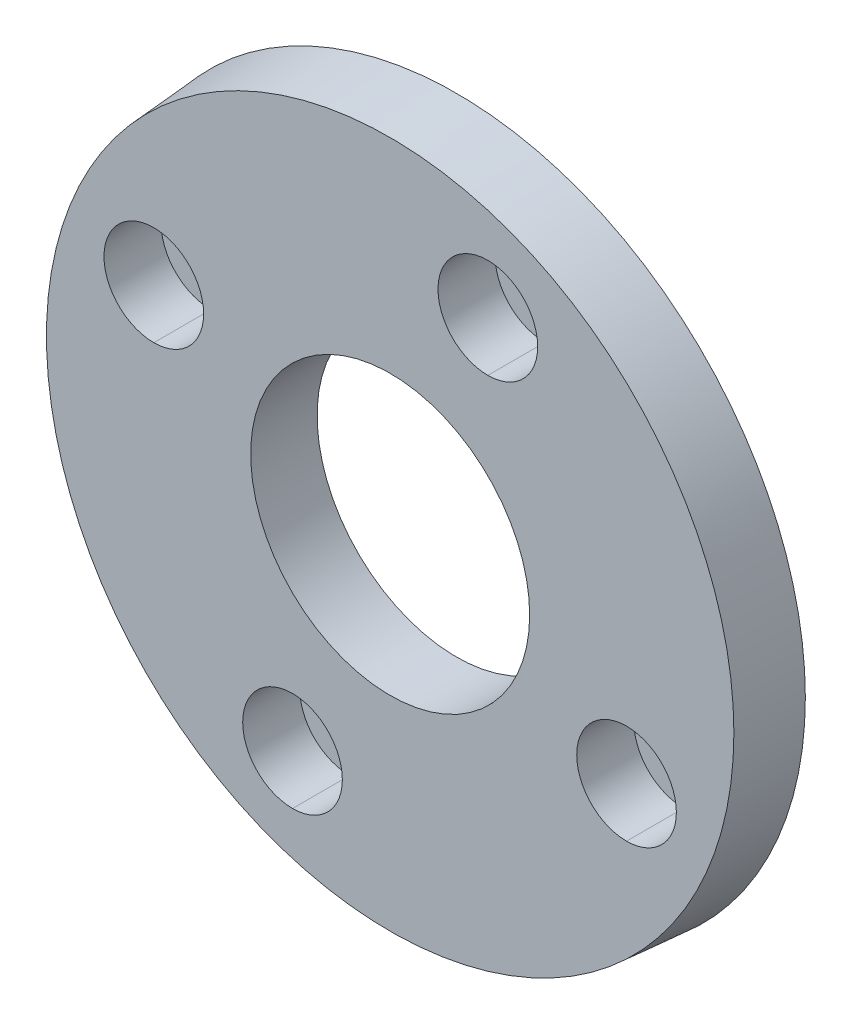
from build123d import *

# Parameters (mm, degrees)
IZIM1_R                                           = 52.5
IZIM1_R_2                                         = 21
Y_KSEKLIK_EKSTR_ZYON1_DEPTH                       = 10
Y_KSEKLIK_EKSTR_ZYON1_DRAFT                       = 4.33
M8_ALT_GEN_ALYAN_BA_L_K_R_VIDA_IN_HAV_D           = 9
M8_ALT_GEN_ALYAN_BA_L_K_R_VIDA_IN_HAV_DEPTH       = 22.25
M8_ALT_GEN_ALYAN_BA_L_K_R_VIDA_IN_HAV_CBORE_D     = 15
M8_ALT_GEN_ALYAN_BA_L_K_R_VIDA_IN_HAV_CBORE_DEPTH = 8.6
M8_ALT_GEN_ALYAN_BA_L_K_R_VIDA_IN_HAV_TIP         = 2.703872786
IZIM4_R                                           = 22
IZIM4_R_2                                         = 21
Y_KSEKLIK_EKSTR_ZYON2_DEPTH                       = 10


with BuildPart() as part:
    # Çizim1 → Yükseklik-Ekstrüzyon1 (with draft: the straight prism first)
    with BuildSketch(Plane.XY):
        Circle(IZIM1_R)
        Circle(IZIM1_R_2, mode=Mode.SUBTRACT)
    extrude(amount=Y_KSEKLIK_EKSTR_ZYON1_DEPTH)
    # Yükseklik-Ekstrüzyon1: the draft: its side faces are tilted about the plane it starts from
    y_kseklik_ekstr_zyon1_sides = [part.faces().sort_by_distance(p)[0] for p in [
        (-52.5, 0, 5),
        (-21, 0, 5),
    ]]
    draft(y_kseklik_ekstr_zyon1_sides, Plane.XY, Y_KSEKLIK_EKSTR_ZYON1_DRAFT)

    # M8 Altıgen Alyan Başlı Kör Vida İçin Havşa1
    with Locations(Plane.XY.offset(10)):
        with Locations((14.701198769, 35.58264682), (-35.58264682, 14.701198769), (-14.701198769, -35.58264682), (35.58264682, -14.701198769)):
            CounterBoreHole(M8_ALT_GEN_ALYAN_BA_L_K_R_VIDA_IN_HAV_D / 2, M8_ALT_GEN_ALYAN_BA_L_K_R_VIDA_IN_HAV_CBORE_D / 2, M8_ALT_GEN_ALYAN_BA_L_K_R_VIDA_IN_HAV_CBORE_DEPTH, depth=M8_ALT_GEN_ALYAN_BA_L_K_R_VIDA_IN_HAV_DEPTH)
            with Locations((0, 0, -(M8_ALT_GEN_ALYAN_BA_L_K_R_VIDA_IN_HAV_DEPTH + M8_ALT_GEN_ALYAN_BA_L_K_R_VIDA_IN_HAV_TIP / 2))):  # 118° drill point
                Cone(0, M8_ALT_GEN_ALYAN_BA_L_K_R_VIDA_IN_HAV_D / 2, M8_ALT_GEN_ALYAN_BA_L_K_R_VIDA_IN_HAV_TIP, mode=Mode.SUBTRACT)

    # Çizim4 → Yükseklik-Ekstrüzyon2 (add)
    with BuildSketch(Plane.XY):
        Circle(IZIM4_R)
        Circle(IZIM4_R_2, mode=Mode.SUBTRACT)
    extrude(amount=Y_KSEKLIK_EKSTR_ZYON2_DEPTH)


solid = part.part
